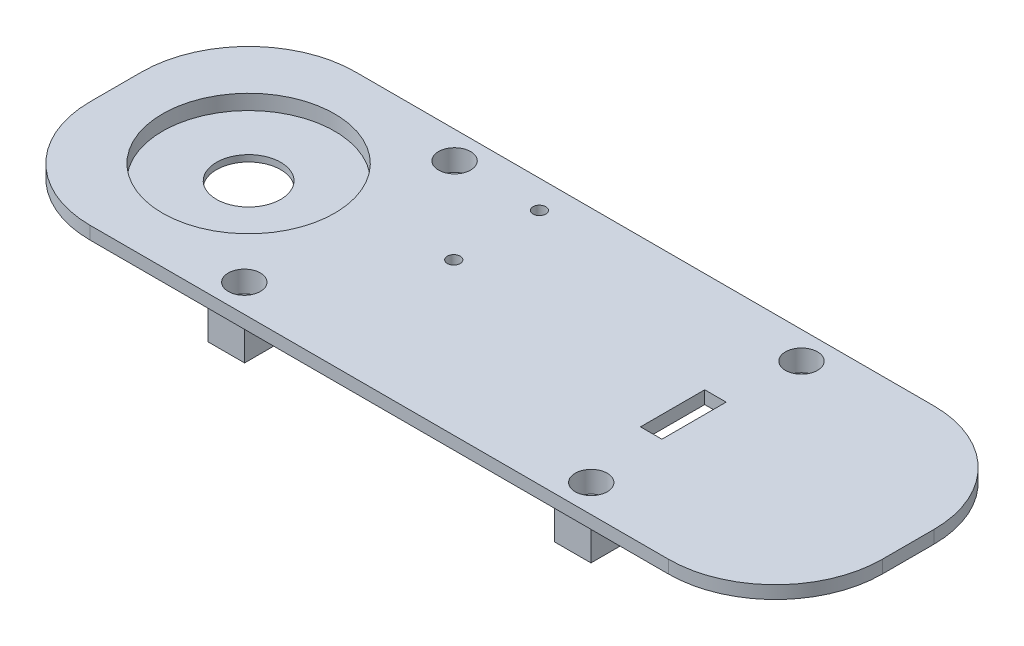
from build123d import *

# Parameters (mm, degrees)
SKETCH1_W                = 185
SKETCH1_H                = 62
BOSS_EXTRUDE1_DEPTH      = 70
FILLET1_R                = 25
CUT_EXTRUDE6_DEPTH       = 64
SKETCH11_R               = 25
CUT_EXTRUDE9_DEPTH       = 17
SKETCH16_R               = 21
BOSS_EXTRUDE6_DEPTH      = 5
SKETCH17_R               = 20.1
CUT_EXTRUDE12_DEPTH      = 3.5
SKETCH20_R               = 25
CUT_EXTRUDE14_DEPTH      = 5.5
SKETCH25_W               = 40
SKETCH25_H               = 8
CUT_EXTRUDE16_DEPTH      = 14
CUT_EXTRUDE21_DEPTH      = 0.1
SKETCH28_R               = 25
BOSS_EXTRUDE10_DEPTH     = 1
SKETCH29_W               = 5
SKETCH29_H               = 15
CUT_EXTRUDE22_DEPTH      = 5
CUT_EXTRUDE24_DEPTH      = 73
CUT_EXTRUDE24_DEPTH_BACK = 44
SKETCH28_2_R             = 25
SKETCH33_OUTSIDE_W       = 226.368
SKETCH33_OUTSIDE_H       = 103.368
CUT_EXTRUDE25_DEPTH      = 23
SKETCH35_W               = 8.5
SKETCH35_H               = 8.5
SKETCH35_R               = 3.75
SKETCH35_R_2             = 2.1
BOSS_EXTRUDE16_DEPTH     = 12
CUT_EXTRUDE13_DEPTH      = 196.481456921
CUT_EXTRUDE13_DEPTH_BACK = 196.481456921
SKETCH18_R               = 7.5
SKETCH35_5_R             = 3.75
SKETCH35_5_R_2           = 2.1
CUT_EXTRUDE36_DEPTH      = 5
CUT_EXTRUDE37_DEPTH      = 196.481456921
CUT_EXTRUDE37_DEPTH_BACK = 196.481456921
SKETCH35_6_R             = 2.1
SKETCH36_W               = 5
SKETCH36_H               = 5
SKETCH36_R               = 1.5
BOSS_EXTRUDE17_DEPTH     = 9
SKETCH36_5_R             = 1.5
CUT_EXTRUDE38_DEPTH      = 9


with BuildPart() as part:
    # Sketch1 → Boss-Extrude1 (new body)
    with BuildSketch(Plane(origin=(0, 0, 0), x_dir=(1, 0, 0), z_dir=(0, 1, 0))):
        with Locations((92.5, 31)):
            Rectangle(SKETCH1_W, SKETCH1_H)
    extrude(amount=BOSS_EXTRUDE1_DEPTH)

    # Fillet1
    fillet1_edges = [part.edges().sort_by_distance(p)[0] for p in [
        (0, 35, -62),
        (185, 35, -62),
        (185, 35, 0),
        (0, 35, 0),
    ]]
    fillet(fillet1_edges, radius=FILLET1_R)

    # Sketch7 → Cut-Extrude6 (cut)
    with BuildSketch(Plane(origin=(0, 67, 0), x_dir=(1, 0, 0), z_dir=(0, 1, 0))):
        with BuildLine():
            Line((25, 58), (160, 58))
            ThreePointArc((160, 58), (174.849242405, 51.849242405), (181, 37))
            Line((181, 37), (181, 25))
            ThreePointArc((181, 25), (174.849242405, 10.150757595), (160, 4))
            Line((160, 4), (25, 4))
            ThreePointArc((25, 4), (10.150757595, 10.150757595), (4, 25))
            Line((4, 25), (4, 37))
            ThreePointArc((4, 37), (10.150757595, 51.849242405), (25, 58))
        make_face()
    extrude(amount=-CUT_EXTRUDE6_DEPTH, mode=Mode.SUBTRACT)

    # Sketch11 → Cut-Extrude9 (cut)
    with BuildSketch(Plane.XZ):
        with Locations(Location((154, -31, 0), (0, 0, 270))):
            Circle(SKETCH11_R)
    extrude(amount=-CUT_EXTRUDE9_DEPTH, mode=Mode.SUBTRACT)

    # Sketch16 → Boss-Extrude6 (add)
    with BuildSketch(Plane(origin=(0, 70, 0), x_dir=(1, 0, 0), z_dir=(0, 1, 0))):
        with Locations(Location((31, 31, 0), (0, 0, 270))):
            Circle(SKETCH16_R)
    extrude(amount=-BOSS_EXTRUDE6_DEPTH)

    # Sketch17 → Cut-Extrude12 (cut)
    with BuildSketch(Plane(origin=(0, 70, 0), x_dir=(1, 0, 0), z_dir=(0, 1, 0))):
        with Locations(Location((31, 31, 0), (0, 0, 270))):
            Circle(SKETCH17_R)
    extrude(amount=-CUT_EXTRUDE12_DEPTH, mode=Mode.SUBTRACT)

    # Sketch20 → Cut-Extrude14 (cut)
    with BuildSketch(Plane.XZ):
        with Locations(Location((31, -31, 0), (0, 0, 270))):
            Circle(SKETCH20_R)
    extrude(amount=-CUT_EXTRUDE14_DEPTH, mode=Mode.SUBTRACT)

    # Sketch25 → Cut-Extrude16 (cut)
    with BuildSketch(Plane.ZY):
        with Locations((-31, 35)):
            Rectangle(SKETCH25_W, SKETCH25_H)
    extrude(amount=-CUT_EXTRUDE16_DEPTH, mode=Mode.SUBTRACT)

    # Sketch27 → Cut-Extrude21 (cut)
    with BuildSketch(Plane(origin=(0, 67, 0), x_dir=(1, 0, 0), z_dir=(0, 1, 0))):
        with BuildLine():
            Line((31, 73.5576089), (197.227071292, 73.5576089))
            ThreePointArc((197.227071292, 73.5576089), (239.784680192, 31), (197.227071292, -11.5576089))
            Line((197.227071292, -11.5576089), (31, -11.5576089))
            ThreePointArc((31, -11.5576089), (-11.5576089, 31), (31, 73.5576089))
        make_face()
        with BuildLine():
            Line((4.02, 37), (4.02, 25))
            ThreePointArc((4.02, 25), (10.164899731, 10.164899731), (25, 4.02))
            Line((25, 4.02), (160, 4.02))
            ThreePointArc((160, 4.02), (174.835100269, 10.164899731), (180.98, 25))
            Line((180.98, 25), (180.98, 37))
            ThreePointArc((180.98, 37), (174.835100269, 51.835100269), (160, 57.98))
            Line((160, 57.98), (25, 57.98))
            ThreePointArc((25, 57.98), (10.164899731, 51.835100269), (4.02, 37))
        make_face(mode=Mode.SUBTRACT)
    extrude(amount=-CUT_EXTRUDE21_DEPTH, mode=Mode.SUBTRACT)


with BuildPart() as cut_extrude21_piece_1:
    # of the separate pieces the step leaves, piece 1, a body of its own (cut_extrude21_pieces)
    add(part.part.solids().sort_by_distance((25, 0, 0))[0])

    # Sketch28 → Boss-Extrude10 (add)
    with BuildSketch(Plane.XZ):
        with BuildLine():
            Line((25, 0), (160, 0))
            ThreePointArc((160, 0), (177.67766953, -7.32233047), (185, -25))
            Line((185, -25), (185, -37))
            ThreePointArc((185, -37), (177.67766953, -54.67766953), (160, -62))
            Line((160, -62), (25, -62))
            ThreePointArc((25, -62), (7.32233047, -54.67766953), (0, -37))
            Line((0, -37), (0, -25))
            ThreePointArc((0, -25), (7.32233047, -7.32233047), (25, 0))
        make_face()
        with Locations(Location((31, -31, 0), (0, 0, 270))):
            Circle(SKETCH28_R, mode=Mode.SUBTRACT)
        with Locations(Location((154, -31, 0), (0, 0, 270))):
            Circle(SKETCH28_R, mode=Mode.SUBTRACT)
    extrude(amount=BOSS_EXTRUDE10_DEPTH)

    # Sketch28<2> → Cut-Extrude24 (cut, two sides: drawn at the far end of the back side and taken through both)
    with BuildSketch(Plane.XZ.offset(-CUT_EXTRUDE24_DEPTH_BACK)):
        with BuildLine():
            Line((25, 0), (160, 0))
            ThreePointArc((160, 0), (177.67766953, -7.32233047), (185, -25))
            Line((185, -25), (185, -37))
            ThreePointArc((185, -37), (177.67766953, -54.67766953), (160, -62))
            Line((160, -62), (25, -62))
            ThreePointArc((25, -62), (7.32233047, -54.67766953), (0, -37))
            Line((0, -37), (0, -25))
            ThreePointArc((0, -25), (7.32233047, -7.32233047), (25, 0))
        make_face()
        with Locations((31, -31)):
            Circle(SKETCH28_2_R, mode=Mode.SUBTRACT)
        with Locations((154, -31)):
            Circle(SKETCH28_2_R, mode=Mode.SUBTRACT)
    extrude(amount=CUT_EXTRUDE24_DEPTH + CUT_EXTRUDE24_DEPTH_BACK, mode=Mode.SUBTRACT)

    # Sketch33 outside → Cut-Extrude25 (cut)
    with BuildSketch(Plane.XZ.offset(-44)):
        with Locations((92.5, -31)):
            Rectangle(SKETCH33_OUTSIDE_W, SKETCH33_OUTSIDE_H)
        with BuildLine():
            Line((25, -4), (160, -4))
            ThreePointArc((160, -4), (174.849242405, -10.150757595), (181, -25))
            Line((181, -25), (181, -37))
            ThreePointArc((181, -37), (174.849242405, -51.849242405), (160, -58))
            Line((160, -58), (25, -58))
            ThreePointArc((25, -58), (10.150757595, -51.849242405), (4, -37))
            Line((4, -37), (4, -25))
            ThreePointArc((4, -25), (10.150757595, -10.150757595), (25, -4))
        make_face(mode=Mode.SUBTRACT)
    extrude(amount=-CUT_EXTRUDE25_DEPTH, mode=Mode.SUBTRACT)


with BuildPart() as cut_extrude21_piece_2:
    # of the separate pieces the step leaves, piece 2, a body of its own (cut_extrude21_pieces)
    add(part.part.solids().sort_by_distance((160, 67, 0))[0])

    # Sketch29 → Cut-Extrude22 (cut)
    with BuildSketch(Plane(origin=(0, 70, 0), x_dir=(1, 0, 0), z_dir=(0, 1, 0))):
        with Locations((132.5, 31)):
            Rectangle(SKETCH29_W, SKETCH29_H)
    extrude(amount=-CUT_EXTRUDE22_DEPTH, mode=Mode.SUBTRACT)

    # Sketch35 → Boss-Extrude16 (add)
    # profile 1 of 8: a face of its own
    with BuildSketch(Plane(origin=(0, 70, 0), x_dir=(1, 0, 0), z_dir=(0, 1, 0))):
        with Locations((54.613267141, 55.55)):
            Rectangle(SKETCH35_W, SKETCH35_H)
        with Locations((54.5, 55.592077299)):
            Circle(SKETCH35_R, mode=Mode.SUBTRACT)
    # profile 2 of 8: a face of its own
    with BuildSketch(Plane(origin=(0, 70, 0), x_dir=(1, 0, 0), z_dir=(0, 1, 0))):
        with Locations((54.5, 55.592077299)):
            Circle(SKETCH35_R)
        with Locations(Location((54.5, 55.592077299, 0), (0, 0, 270))):
            Circle(SKETCH35_R_2, mode=Mode.SUBTRACT)
    # profile 3 of 8: a face of its own
    with BuildSketch(Plane(origin=(0, 70, 0), x_dir=(1, 0, 0), z_dir=(0, 1, 0))):
        with Locations((54.613267141, 6.45)):
            Rectangle(SKETCH35_W, SKETCH35_H)
        with Locations((54.5, 6.5)):
            Circle(SKETCH35_R, mode=Mode.SUBTRACT)
    # profile 4 of 8: a face of its own
    with BuildSketch(Plane(origin=(0, 70, 0), x_dir=(1, 0, 0), z_dir=(0, 1, 0))):
        with Locations((54.5, 6.5)):
            Circle(SKETCH35_R)
        with Locations(Location((54.5, 6.5, 0), (0, 0, 270))):
            Circle(SKETCH35_R_2, mode=Mode.SUBTRACT)
    # profile 5 of 8: a face of its own
    with BuildSketch(Plane(origin=(0, 70, 0), x_dir=(1, 0, 0), z_dir=(0, 1, 0))):
        with Locations((135.488094084, 6.45)):
            Rectangle(SKETCH35_W, SKETCH35_H)
        with Locations((135.5, 6.5)):
            Circle(SKETCH35_R, mode=Mode.SUBTRACT)
    # profile 6 of 8: a face of its own
    with BuildSketch(Plane(origin=(0, 70, 0), x_dir=(1, 0, 0), z_dir=(0, 1, 0))):
        with Locations((135.5, 6.5)):
            Circle(SKETCH35_R)
        with Locations(Location((135.5, 6.5, 0), (0, 0, 270))):
            Circle(SKETCH35_R_2, mode=Mode.SUBTRACT)
    # profile 7 of 8: a face of its own
    with BuildSketch(Plane(origin=(0, 70, 0), x_dir=(1, 0, 0), z_dir=(0, 1, 0))):
        with Locations((135.488094084, 55.55)):
            Rectangle(SKETCH35_W, SKETCH35_H)
        with Locations((135.5, 55.592077299)):
            Circle(SKETCH35_R, mode=Mode.SUBTRACT)
    # profile 8 of 8: a face of its own
    with BuildSketch(Plane(origin=(0, 70, 0), x_dir=(1, 0, 0), z_dir=(0, 1, 0))):
        with Locations((135.5, 55.592077299)):
            Circle(SKETCH35_R)
        with Locations(Location((135.5, 55.592077299, 0), (0, 0, 270))):
            Circle(SKETCH35_R_2, mode=Mode.SUBTRACT)
    extrude(amount=-BOSS_EXTRUDE16_DEPTH)

    # Sketch18 → Cut-Extrude13 (cut, two sides: drawn at the far end of the back side and taken through both)
    with BuildSketch(Plane(origin=(0, 70, 0), x_dir=(1, 0, 0), z_dir=(0, 1, 0)).offset(-CUT_EXTRUDE13_DEPTH_BACK)):
        with Locations(Location((31, 31, 0), (0, 0, 270))):
            Circle(SKETCH18_R)
    extrude(amount=CUT_EXTRUDE13_DEPTH + CUT_EXTRUDE13_DEPTH_BACK, mode=Mode.SUBTRACT)

    # Sketch35<5> → Cut-Extrude36 (cut)
    # profile 1 of 4: a face of its own
    with BuildSketch(Plane(origin=(0, 70, 0), x_dir=(1, 0, 0), z_dir=(0, 1, 0))):
        with Locations(Location((54.5, 6.5, 0), (0, 0, 270))):
            Circle(SKETCH35_5_R)
        with Locations(Location((54.5, 6.5, 0), (0, 0, 270))):
            Circle(SKETCH35_5_R_2, mode=Mode.SUBTRACT)
    # profile 2 of 4: a face of its own
    with BuildSketch(Plane(origin=(0, 70, 0), x_dir=(1, 0, 0), z_dir=(0, 1, 0))):
        with Locations(Location((54.5, 55.592077299, 0), (0, 0, 270))):
            Circle(SKETCH35_5_R)
        with Locations(Location((54.5, 55.592077299, 0), (0, 0, 270))):
            Circle(SKETCH35_5_R_2, mode=Mode.SUBTRACT)
    # profile 3 of 4: a face of its own
    with BuildSketch(Plane(origin=(0, 70, 0), x_dir=(1, 0, 0), z_dir=(0, 1, 0))):
        with Locations(Location((135.5, 55.592077299, 0), (0, 0, 270))):
            Circle(SKETCH35_5_R)
        with Locations(Location((135.5, 55.592077299, 0), (0, 0, 270))):
            Circle(SKETCH35_5_R_2, mode=Mode.SUBTRACT)
    # profile 4 of 4: a face of its own
    with BuildSketch(Plane(origin=(0, 70, 0), x_dir=(1, 0, 0), z_dir=(0, 1, 0))):
        with Locations(Location((135.5, 6.5, 0), (0, 0, 270))):
            Circle(SKETCH35_5_R)
        with Locations(Location((135.5, 6.5, 0), (0, 0, 270))):
            Circle(SKETCH35_5_R_2, mode=Mode.SUBTRACT)
    extrude(amount=-CUT_EXTRUDE36_DEPTH, mode=Mode.SUBTRACT)


with BuildPart() as cut_extrude36_piece_1:
    # of the separate pieces the step leaves, piece 1, a body of its own (cut_extrude36_pieces_kept)
    add(cut_extrude21_piece_2.part.solids().sort_by_distance((160, 67, 0))[0])

    # Sketch36 → Boss-Extrude17 (add)
    # profile 1 of 2: a face of its own
    with BuildSketch(Plane.XZ.offset(-70)):
        with Locations((74.426021402, -55.469089395)):
            Rectangle(SKETCH36_W, SKETCH36_H)
        with Locations(Location((74.426021402, -55.469089395, 0), (0, 0, 90))):
            Circle(SKETCH36_R, mode=Mode.SUBTRACT)
    # profile 2 of 2: a face of its own
    with BuildSketch(Plane.XZ.offset(-70)):
        with Locations((74.427115809, -35.736444324)):
            Rectangle(SKETCH36_W, SKETCH36_H)
        with Locations(Location((74.426021402, -35.469089395, 0), (0, 0, 90))):
            Circle(SKETCH36_R, mode=Mode.SUBTRACT)
    extrude(amount=BOSS_EXTRUDE17_DEPTH)

    # Sketch36<5> → Cut-Extrude38 (cut)
    with BuildSketch(Plane.XZ.offset(-70)):
        with Locations(Location((74.426021402, -55.469089395, 0), (0, 0, 90))):
            Circle(SKETCH36_5_R)
        with Locations(Location((74.426021402, -35.469089395, 0), (0, 0, 90))):
            Circle(SKETCH36_5_R)
    extrude(amount=CUT_EXTRUDE38_DEPTH, mode=Mode.SUBTRACT)


with BuildPart() as cut_extrude36_piece_2:
    # of the separate pieces the step leaves, piece 2, a body of its own (cut_extrude36_pieces_kept)
    add(cut_extrude21_piece_2.part.solids().sort_by_distance((54.5, 70, -4.4))[0])


with BuildPart() as cut_extrude36_piece_3:
    # of the separate pieces the step leaves, piece 3, a body of its own (cut_extrude36_pieces_kept)
    add(cut_extrude21_piece_2.part.solids().sort_by_distance((135.5, 70, -53.492077299))[0])


with BuildPart() as cut_extrude37_tool:
    # Sketch35<6> → Cut-Extrude37 (new, two sides: drawn at the far end of the back side and taken through both)
    with BuildSketch(Plane(origin=(0, 70, 0), x_dir=(1, 0, 0), z_dir=(0, 1, 0)).offset(-CUT_EXTRUDE37_DEPTH_BACK)):
        with Locations(Location((54.5, 6.5, 0), (0, 0, 270))):
            Circle(SKETCH35_6_R)
        with Locations(Location((54.5, 55.592077299, 0), (0, 0, 270))):
            Circle(SKETCH35_6_R)
        with Locations(Location((135.5, 55.592077299, 0), (0, 0, 270))):
            Circle(SKETCH35_6_R)
        with Locations(Location((135.5, 6.5, 0), (0, 0, 270))):
            Circle(SKETCH35_6_R)
    extrude(amount=CUT_EXTRUDE37_DEPTH + CUT_EXTRUDE37_DEPTH_BACK)


with BuildPart() as cut_extrude36_piece_2_1:
    add(cut_extrude36_piece_2.part)

    # Cut-Extrude37: cut by cut_extrude37_tool
    add(cut_extrude37_tool.part, mode=Mode.SUBTRACT)


with BuildPart() as cut_extrude36_piece_3_1:
    add(cut_extrude36_piece_3.part)

    # Cut-Extrude37: cut by cut_extrude37_tool
    add(cut_extrude37_tool.part, mode=Mode.SUBTRACT)


solid = cut_extrude36_piece_1.part
